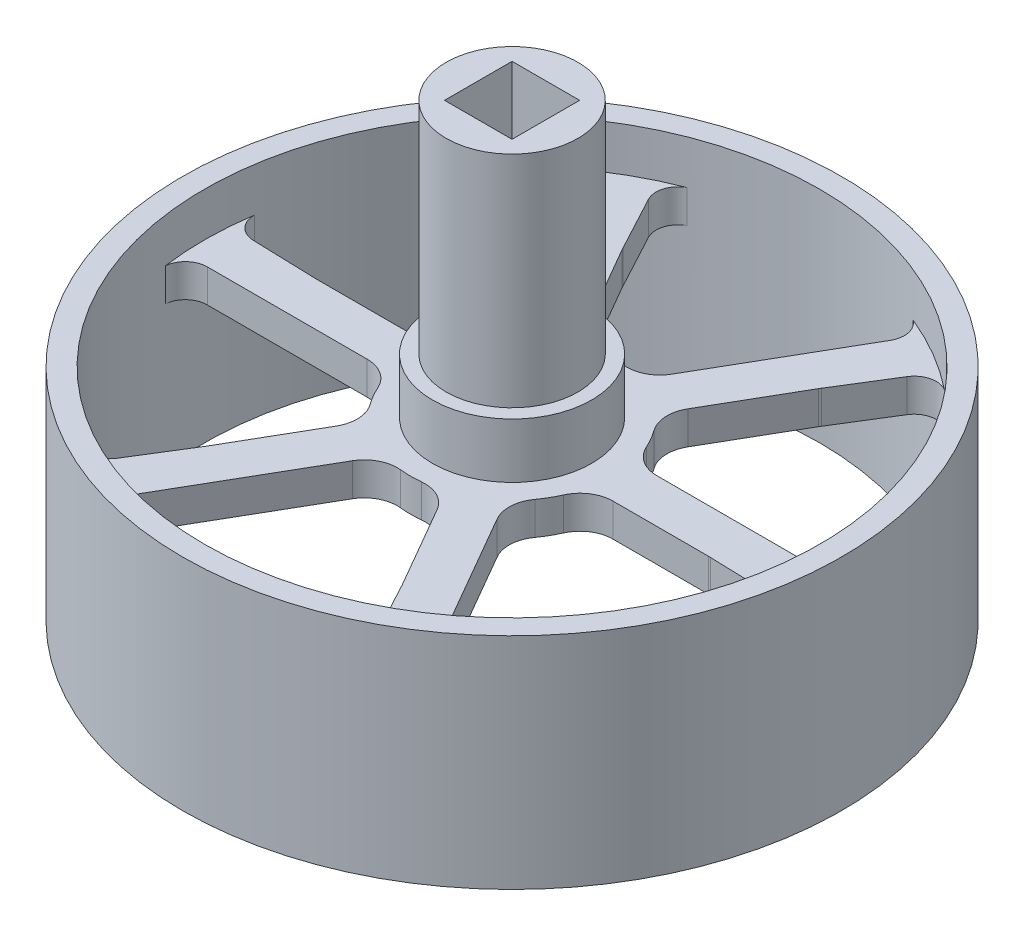
from build123d import *
from build123d.topology import SkipClean

# Parameters (mm, degrees)
SKETCH1_R           = 30
SKETCH1_R_2         = 28
BOSS_EXTRUDE1_DEPTH = 10
BOSS_EXTRUDE2_START = 3
SKETCH2_R           = 28
BOSS_EXTRUDE2_DEPTH = 3
BOSS_EXTRUDE3_START = -3
SKETCH3_R           = 7.25
BOSS_EXTRUDE3_DEPTH = 5
SKETCH4_R           = 6
BOSS_EXTRUDE4_DEPTH = 20
CUT_EXTRUDE2_DEPTH  = 9
CUT_EXTRUDE3_DEPTH  = 10
SKETCH8_W           = 6.148821926
SKETCH8_H           = 6.148821926
CUT_EXTRUDE4_DEPTH  = 20


with BuildPart() as part:
    # Sketch1 → Boss-Extrude1 (new, symmetric)
    with BuildSketch(Plane(origin=(0, 0, 0), x_dir=(1, 0, 0), z_dir=(0, 1, 0))):
        with Locations(Location((0, 0, 0), (0, 0, 270))):
            Circle(SKETCH1_R)
        with Locations(Location((0, 0, 0), (0, 0, 270))):
            Circle(SKETCH1_R_2, mode=Mode.SUBTRACT)
    extrude(amount=BOSS_EXTRUDE1_DEPTH, both=True)

    # Sketch2 → Boss-Extrude2 (add)
    with BuildSketch(Plane(origin=(0, 0, 0), x_dir=(1, 0, 0), z_dir=(0, 1, 0)).offset(BOSS_EXTRUDE2_START)):
        with Locations(Location((0, 0, 0), (0, 0, 270))):
            Circle(SKETCH2_R)
    extrude(amount=BOSS_EXTRUDE2_DEPTH)

    # Sketch3 → Boss-Extrude3 (add)
    with BuildSketch(Plane.XZ.offset(-3).offset(BOSS_EXTRUDE3_START)):
        with Locations(Location((0, 0, 0), (0, 0, 90))):
            Circle(SKETCH3_R)
    extrude(amount=-BOSS_EXTRUDE3_DEPTH)

    # Sketch4 → Boss-Extrude4 (add)
    with BuildSketch(Plane(origin=(0, 11, 0), x_dir=(-1, 0, 0), z_dir=(0, 1, 0))):
        with Locations(Location((0, 0, 0), (0, 0, 90))):
            Circle(SKETCH4_R)
    extrude(amount=BOSS_EXTRUDE4_DEPTH)

    # Sketch6 → Cut-Extrude2 (cut)
    with BuildSketch(Plane.XZ.offset(-3)):
        with BuildLine():
            ThreePointArc((-7.491891637, 5.425316552), (-8.010734985, 4.625), (-8.444407777, 3.775510204))
            ThreePointArc((-8.444407777, 3.775510204), (-9.551183243, 2.48271283), (-11.183134623, 2))
            Line((-11.183134623, 2), (-19.880895352, 2))
            ThreePointArc((-19.880895352, 2), (-22.246811871, 3.155429854), (-22.790294672, 5.731707317))
            ThreePointArc((-22.790294672, 5.731707317), (-20.351596989, 11.75), (-16.35895148, 16.871120487))
            ThreePointArc((-16.35895148, 16.871120487), (-13.856088349, 17.688589307), (-11.672498484, 16.217360425))
            Line((-11.672498484, 16.217360425), (-7.323618119, 8.684878678))
            ThreePointArc((-7.323618119, 8.684878678), (-6.925684003, 7.03021091), (-7.491891637, 5.425316552))
        make_face()
        with BuildLine():
            ThreePointArc((6.431343192, 22.602827804), (0, 23.5), (-6.431343192, 22.602827804))
            ThreePointArc((-6.431343192, 22.602827804), (-8.390723522, 20.844019161), (-8.208396868, 18.217360425))
            Line((-8.208396868, 18.217360425), (-3.859516504, 10.684878678))
            ThreePointArc((-3.859516504, 10.684878678), (-2.62549924, 9.51292374), (-0.952516139, 9.200826757))
            ThreePointArc((-0.952516139, 9.200826757), (0, 9.25), (0.952516139, 9.200826757))
            ThreePointArc((0.952516139, 9.200826757), (2.62549924, 9.51292374), (3.859516504, 10.684878678))
            Line((3.859516504, 10.684878678), (8.208396868, 18.217360425))
            ThreePointArc((8.208396868, 18.217360425), (8.390723522, 20.844019161), (6.431343192, 22.602827804))
        make_face()
        with BuildLine():
            ThreePointArc((8.444407777, 3.775510204), (8.010734985, 4.625), (7.491891637, 5.425316552))
            ThreePointArc((7.491891637, 5.425316552), (6.925684003, 7.03021091), (7.323618119, 8.684878678))
            Line((7.323618119, 8.684878678), (11.672498484, 16.217360425))
            ThreePointArc((11.672498484, 16.217360425), (13.856088349, 17.688589307), (16.35895148, 16.871120487))
            ThreePointArc((16.35895148, 16.871120487), (20.351596989, 11.75), (22.790294672, 5.731707317))
            ThreePointArc((22.790294672, 5.731707317), (22.246811871, 3.155429854), (19.880895352, 2))
            Line((19.880895352, 2), (11.183134623, 2))
            ThreePointArc((11.183134623, 2), (9.551183243, 2.48271283), (8.444407777, 3.775510204))
        make_face()
        with BuildLine():
            ThreePointArc((7.491891637, -5.425316552), (8.010734985, -4.625), (8.444407777, -3.775510204))
            ThreePointArc((8.444407777, -3.775510204), (9.551183243, -2.48271283), (11.183134623, -2))
            Line((11.183134623, -2), (19.880895352, -2))
            ThreePointArc((19.880895352, -2), (22.246811871, -3.155429854), (22.790294672, -5.731707317))
            ThreePointArc((22.790294672, -5.731707317), (20.351596989, -11.75), (16.35895148, -16.871120487))
            ThreePointArc((16.35895148, -16.871120487), (13.856088349, -17.688589307), (11.672498484, -16.217360425))
            Line((11.672498484, -16.217360425), (7.323618119, -8.684878678))
            ThreePointArc((7.323618119, -8.684878678), (6.925684003, -7.03021091), (7.491891637, -5.425316552))
        make_face()
        with BuildLine():
            ThreePointArc((-0.952516139, -9.200826757), (0, -9.25), (0.952516139, -9.200826757))
            ThreePointArc((0.952516139, -9.200826757), (2.62549924, -9.51292374), (3.859516504, -10.684878678))
            Line((3.859516504, -10.684878678), (8.208396868, -18.217360425))
            ThreePointArc((8.208396868, -18.217360425), (8.390723522, -20.844019161), (6.431343192, -22.602827804))
            ThreePointArc((6.431343192, -22.602827804), (0, -23.5), (-6.431343192, -22.602827804))
            ThreePointArc((-6.431343192, -22.602827804), (-8.390723522, -20.844019161), (-8.208396868, -18.217360425))
            Line((-8.208396868, -18.217360425), (-3.859516504, -10.684878678))
            ThreePointArc((-3.859516504, -10.684878678), (-2.62549924, -9.51292374), (-0.952516139, -9.200826757))
        make_face()
        with BuildLine():
            ThreePointArc((-8.444407777, -3.775510204), (-8.010734985, -4.625), (-7.491891637, -5.425316552))
            ThreePointArc((-7.491891637, -5.425316552), (-6.925684003, -7.03021091), (-7.323618119, -8.684878678))
            Line((-7.323618119, -8.684878678), (-11.672498484, -16.217360425))
            ThreePointArc((-11.672498484, -16.217360425), (-13.856088349, -17.688589307), (-16.35895148, -16.871120487))
            ThreePointArc((-16.35895148, -16.871120487), (-20.351596989, -11.75), (-22.790294672, -5.731707317))
            ThreePointArc((-22.790294672, -5.731707317), (-22.246811871, -3.155429854), (-19.880895352, -2))
            Line((-19.880895352, -2), (-11.183134623, -2))
            ThreePointArc((-11.183134623, -2), (-9.551183243, -2.48271283), (-8.444407777, -3.775510204))
        make_face()
    extrude(amount=-CUT_EXTRUDE2_DEPTH, mode=Mode.SUBTRACT)

    # Sketch7 → Cut-Extrude3 (cut)
    with SkipClean():  # the faces are left unmerged after this step: merging them gives an invalid solid
        with BuildSketch(Plane.XZ.offset(-3)):
            with BuildLine():
                ThreePointArc((-14.761784894, 21.200434556), (-16.000690703, 22.09276981), (-17.508222547, 21.850907149))
                ThreePointArc((-17.508222547, 21.850907149), (-17.71649371, 21.682385723), (-17.923142901, 21.511879243))
                ThreePointArc((-17.923142901, 21.511879243), (-24.248711306, 14), (-27.591405358, 4.765957447))
                ThreePointArc((-27.591405358, 4.765957447), (-27.668012437, 4.298963572), (-27.736716066, 3.830741686))
                ThreePointArc((-27.736716066, 3.830741686), (-27.096940064, 2.52715978), (-25.74389103, 2))
                Line((-25.74389103, 2), (-19.880895352, 2))
                ThreePointArc((-19.880895352, 2), (-22.246811871, 3.155429854), (-22.790294672, 5.731707317))
                ThreePointArc((-22.790294672, 5.731707317), (-20.351596989, 11.75), (-16.35895148, 16.871120487))
                ThreePointArc((-16.35895148, 16.871120487), (-13.949469899, 17.700126207), (-11.771642309, 16.377281185))
                Line((-11.771642309, 16.377281185), (-14.761784894, 21.200434556))
            make_face()
            with BuildLine():
                ThreePointArc((6.431343192, 22.602827804), (8.354023996, 20.930658406), (8.297320396, 18.383181876))
                Line((8.297320396, 18.383181876), (10.97922245, 23.384298002))
                ThreePointArc((10.97922245, 23.384298002), (11.132554544, 24.903389532), (10.169329414, 26.088019075))
                ThreePointArc((10.169329414, 26.088019075), (9.919249996, 26.18412648), (9.668262457, 26.277836689))
                ThreePointArc((9.668262457, 26.277836689), (0, 28), (-9.668262457, 26.277836689))
                ThreePointArc((-9.668262457, 26.277836689), (-10.110994555, 26.110683429), (-10.550838418, 25.936071574))
                ThreePointArc((-10.550838418, 25.936071574), (-11.359885463, 24.73021835), (-11.139894708, 23.294863625))
                Line((-11.139894708, 23.294863625), (-8.208396868, 18.217360425))
                ThreePointArc((-8.208396868, 18.217360425), (-8.390723522, 20.844019161), (-6.431343192, 22.602827804))
                ThreePointArc((-6.431343192, 22.602827804), (0, 23.5), (6.431343192, 22.602827804))
            make_face()
            with BuildLine():
                ThreePointArc((17.923142901, 21.511879243), (17.557017882, 21.811719856), (17.185877648, 22.105329888))
                ThreePointArc((17.185877648, 22.105329888), (15.737054601, 22.20305857), (14.603996323, 21.294863625))
                Line((14.603996323, 21.294863625), (11.672498484, 16.217360425))
                ThreePointArc((11.672498484, 16.217360425), (13.856088349, 17.688589307), (16.35895148, 16.871120487))
                ThreePointArc((16.35895148, 16.871120487), (20.351596989, 11.75), (22.790294672, 5.731707317))
                ThreePointArc((22.790294672, 5.731707317), (22.303493895, 3.230532199), (20.068962705, 2.005900691))
                Line((20.068962705, 2.005900691), (25.741007344, 2.183863445))
                ThreePointArc((25.741007344, 2.183863445), (27.133245247, 2.810619722), (27.67755196, 4.237111926))
                ThreePointArc((27.67755196, 4.237111926), (27.635743706, 4.501740757), (27.591405358, 4.765957447))
                ThreePointArc((27.591405358, 4.765957447), (24.248711306, 14), (17.923142901, 21.511879243))
            make_face()
            with BuildLine():
                ThreePointArc((27.591405358, -4.765957447), (27.668012437, -4.298963572), (27.736716066, -3.830741686))
                ThreePointArc((27.736716066, -3.830741686), (27.096940064, -2.52715978), (25.74389103, -2))
                Line((25.74389103, -2), (19.880895352, -2))
                ThreePointArc((19.880895352, -2), (22.246811871, -3.155429854), (22.790294672, -5.731707317))
                ThreePointArc((22.790294672, -5.731707317), (20.351596989, -11.75), (16.35895148, -16.871120487))
                ThreePointArc((16.35895148, -16.871120487), (13.949469899, -17.700126207), (11.771642309, -16.377281185))
                Line((11.771642309, -16.377281185), (14.761784894, -21.200434556))
                ThreePointArc((14.761784894, -21.200434556), (16.000690703, -22.09276981), (17.508222547, -21.850907149))
                ThreePointArc((17.508222547, -21.850907149), (17.71649371, -21.682385723), (17.923142901, -21.511879243))
                ThreePointArc((17.923142901, -21.511879243), (24.248711306, -14), (27.591405358, -4.765957447))
            make_face()
            with BuildLine():
                ThreePointArc((9.668262457, -26.277836689), (10.110994555, -26.110683429), (10.550838418, -25.936071574))
                ThreePointArc((10.550838418, -25.936071574), (11.359885463, -24.73021835), (11.139894708, -23.294863625))
                Line((11.139894708, -23.294863625), (8.208396868, -18.217360425))
                ThreePointArc((8.208396868, -18.217360425), (8.390723522, -20.844019161), (6.431343192, -22.602827804))
                ThreePointArc((6.431343192, -22.602827804), (0, -23.5), (-6.431343192, -22.602827804))
                ThreePointArc((-6.431343192, -22.602827804), (-8.354023996, -20.930658406), (-8.297320396, -18.383181876))
                Line((-8.297320396, -18.383181876), (-10.97922245, -23.384298002))
                ThreePointArc((-10.97922245, -23.384298002), (-11.132554544, -24.903389532), (-10.169329414, -26.088019075))
                ThreePointArc((-10.169329414, -26.088019075), (-9.919249996, -26.18412648), (-9.668262457, -26.277836689))
                ThreePointArc((-9.668262457, -26.277836689), (0, -28), (9.668262457, -26.277836689))
            make_face()
            with BuildLine():
                ThreePointArc((-25.741007344, -2.183863445), (-27.133245247, -2.810619722), (-27.67755196, -4.237111926))
                ThreePointArc((-27.67755196, -4.237111926), (-27.635743706, -4.501740757), (-27.591405358, -4.765957447))
                ThreePointArc((-27.591405358, -4.765957447), (-24.248711306, -14), (-17.923142901, -21.511879243))
                ThreePointArc((-17.923142901, -21.511879243), (-17.557017882, -21.811719856), (-17.185877648, -22.105329888))
                ThreePointArc((-17.185877648, -22.105329888), (-15.737054601, -22.20305857), (-14.603996323, -21.294863625))
                Line((-14.603996323, -21.294863625), (-11.672498484, -16.217360425))
                ThreePointArc((-11.672498484, -16.217360425), (-13.856088349, -17.688589307), (-16.35895148, -16.871120487))
                ThreePointArc((-16.35895148, -16.871120487), (-20.351596989, -11.75), (-22.790294672, -5.731707317))
                ThreePointArc((-22.790294672, -5.731707317), (-22.303493895, -3.230532199), (-20.068962705, -2.005900691))
                Line((-20.068962705, -2.005900691), (-25.741007344, -2.183863445))
            make_face()
        extrude(amount=-CUT_EXTRUDE3_DEPTH, mode=Mode.SUBTRACT)

    # Sketch8 → Cut-Extrude4 (cut)
    with SkipClean():  # the faces are left unmerged after this step: merging them gives an invalid solid
        with BuildSketch(Plane(origin=(0, 31, 0), x_dir=(-1, 0, 0), z_dir=(0, 1, 0))):
            Rectangle(SKETCH8_W, SKETCH8_H)
        extrude(amount=-CUT_EXTRUDE4_DEPTH, mode=Mode.SUBTRACT)


solid = part.part
